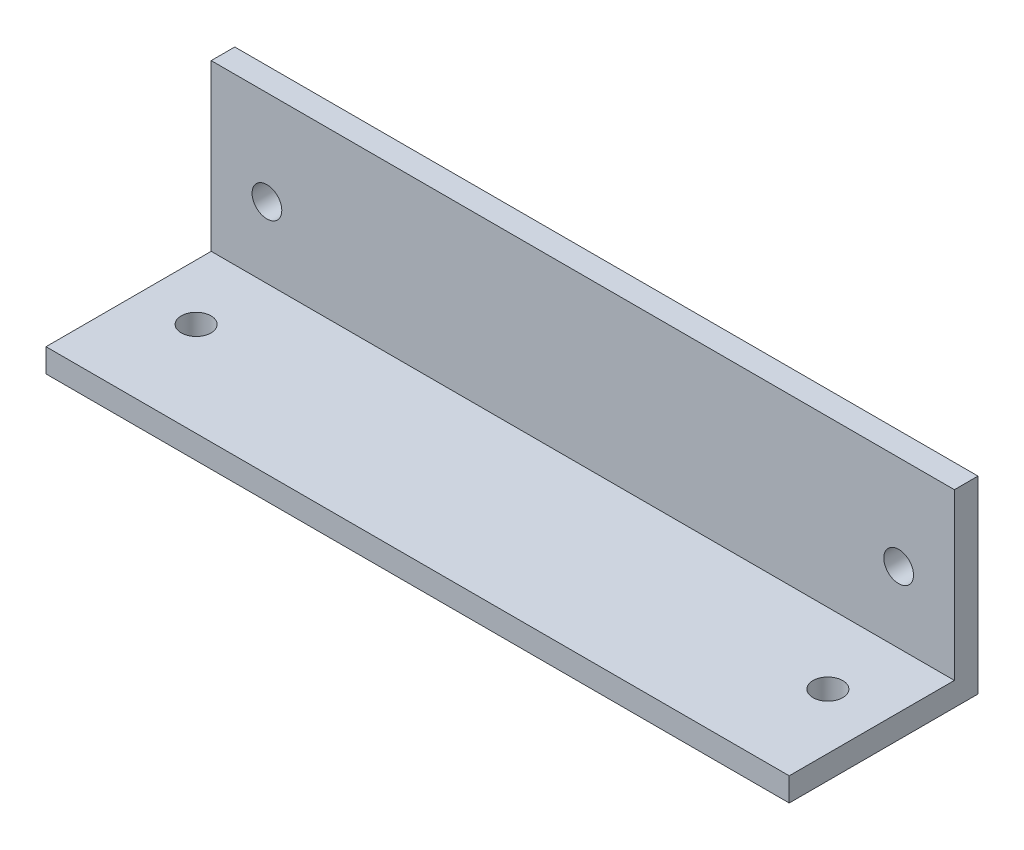
from build123d import *

# Parameters (mm, degrees)
BOSS_EXTRUDE1_DEPTH = 100
CUT_EXTRUDE1_REACH  = 125.131
SKETCH2_R           = 4


with BuildPart() as part:
    # Sketch1 → Boss-Extrude1 (new, symmetric)
    with BuildSketch(Plane(origin=(0, 0, 0), x_dir=(0, 0, -1), z_dir=(1, 0, 0))):
        Polygon((0, 50.8), (0, 0), (-50.8, 0), (-50.8, 6.35), (-6.35, 6.35), (-6.35, 50.8), align=None)
    extrude(amount=BOSS_EXTRUDE1_DEPTH, both=True)

    # Sketch2 → Cut-Extrude1 (cut, up to next)
    with BuildSketch(Plane.XZ, mode=Mode.PRIVATE) as cut_extrude1_sk1:
        with Locations(Location((-85, 25.4, 0), (0, 0, 270))):
            Circle(SKETCH2_R)
    cut_extrude1_tool1 = extrude(cut_extrude1_sk1.sketch, amount=-CUT_EXTRUDE1_REACH, mode=Mode.PRIVATE) & part.part
    # Sketch2 → Cut-Extrude1 (cut, up to next)
    with BuildSketch(Plane.XZ, mode=Mode.PRIVATE) as cut_extrude1_sk2:
        with Locations(Location((85, 25.4, 0), (0, 0, 270))):
            Circle(SKETCH2_R)
    cut_extrude1_tool2 = extrude(cut_extrude1_sk2.sketch, amount=-CUT_EXTRUDE1_REACH, mode=Mode.PRIVATE) & part.part
    cut_extrude1_1 = cut_extrude1_tool1.solids().sort_by_distance((-85, 0, 25.4))[0]
    add(cut_extrude1_1, mode=Mode.SUBTRACT)
    cut_extrude1_2 = cut_extrude1_tool2.solids().sort_by_distance((85, 0, 25.4))[0]
    add(cut_extrude1_2, mode=Mode.SUBTRACT)
    cut_extrude1 = cut_extrude1_1 + cut_extrude1_2  # Cut-Extrude1 as one shape, for the pattern or mirror that repeats it

    # Mirror1: Cut-Extrude1 across plane
    add(cut_extrude1.mirror(Plane(origin=(0, 0, 0), x_dir=(0, 0.7071067811865471, 0.7071067811865479), z_dir=(0, -0.7071067811865479, 0.7071067811865471))), mode=Mode.SUBTRACT)


solid = part.part
